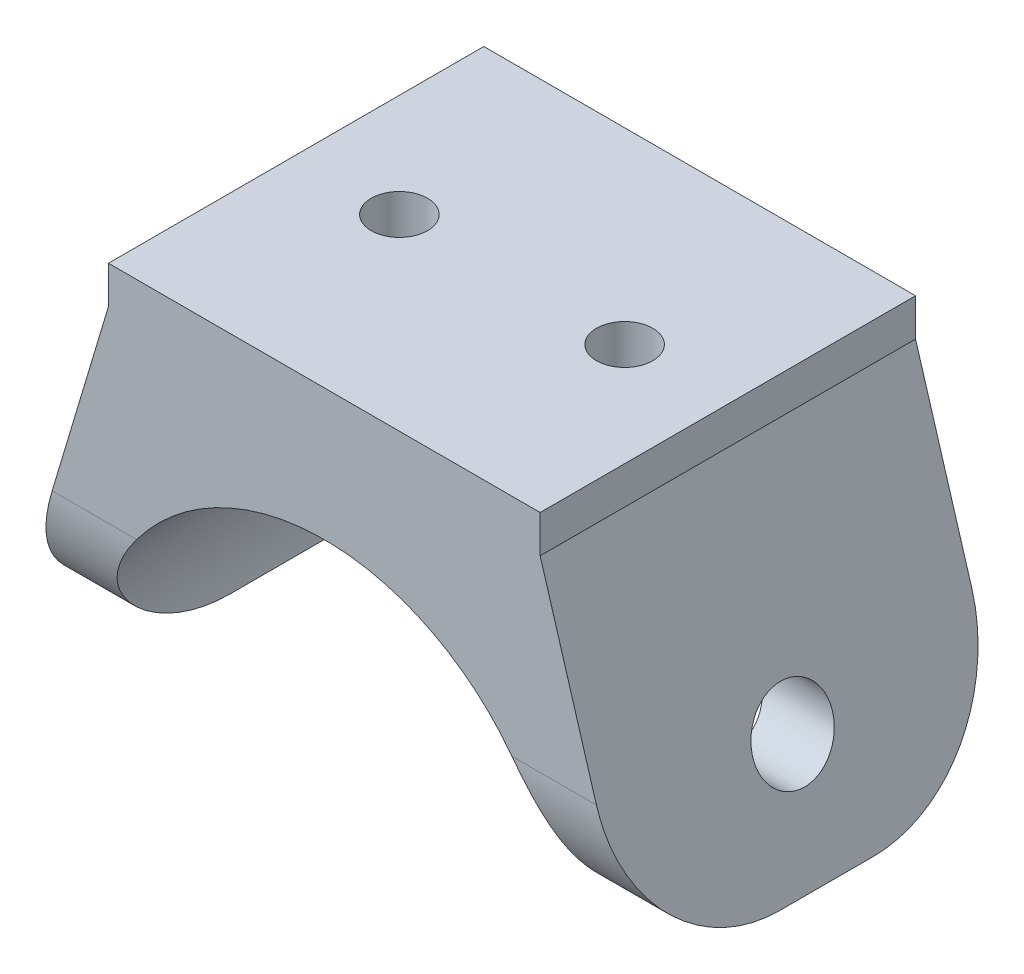
from build123d import *

# Parameters (mm, degrees)
BOSS_EXTRUDE1_DEPTH     = 20
FILLET1_R               = 15
CUT_EXTRUDE1_DEPTH      = 56.162909807
CUT_EXTRUDE1_DEPTH_BACK = 56.162909807
SKETCH3_R               = 4.25
SKETCH4_R               = 3
CUT_EXTRUDE2_DEPTH      = 14


with BuildPart() as part:
    # Sketch1 → Boss-Extrude1 (new, symmetric)
    with BuildSketch(Plane.XY):
        with BuildLine():
            Line((-25, 0), (-33.49547145, 0))
            Line((-33.49547145, 0), (-23, 35))
            Line((-23, 35), (-23, 39))
            Line((-23, 39), (23, 39))
            Line((23, 39), (23, 35))
            Line((23, 35), (33.49547145, 0))
            Line((33.49547145, 0), (25, 0))
            ThreePointArc((25, 0), (0, 25), (-25, 0))
        make_face()
    extrude(amount=BOSS_EXTRUDE1_DEPTH, both=True)

    # Fillet1
    fillet1_edges = [part.edges().sort_by_distance(p)[0] for p in [
        (-29.247735725, 0, 20),
        (29.247735725, 0, 20),
        (29.247735725, 0, -20),
        (-29.247735725, 0, -20),
    ]]
    fillet(fillet1_edges, radius=FILLET1_R)

    # Sketch3 → Cut-Extrude1 (cut, two sides: drawn at the far end of the back side and taken through both)
    with BuildSketch(Plane(origin=(0, 0, 0), x_dir=(0, 0, -1), z_dir=(1, 0, 0)).offset(-CUT_EXTRUDE1_DEPTH_BACK)):
        with Locations((0, 12)):
            Circle(SKETCH3_R)
    extrude(amount=CUT_EXTRUDE1_DEPTH + CUT_EXTRUDE1_DEPTH_BACK, mode=Mode.SUBTRACT)

    # Sketch4 → Cut-Extrude2 (cut)
    with BuildSketch(Plane(origin=(0, 39, 0), x_dir=(1, 0, 0), z_dir=(0, 1, 0))):
        with Locations(Location((-12, 0, 0), (0, 0, 270))):
            Circle(SKETCH4_R)
        with Locations(Location((12, 0, 0), (0, 0, 270))):
            Circle(SKETCH4_R)
    extrude(amount=-CUT_EXTRUDE2_DEPTH, mode=Mode.SUBTRACT)


solid = part.part
